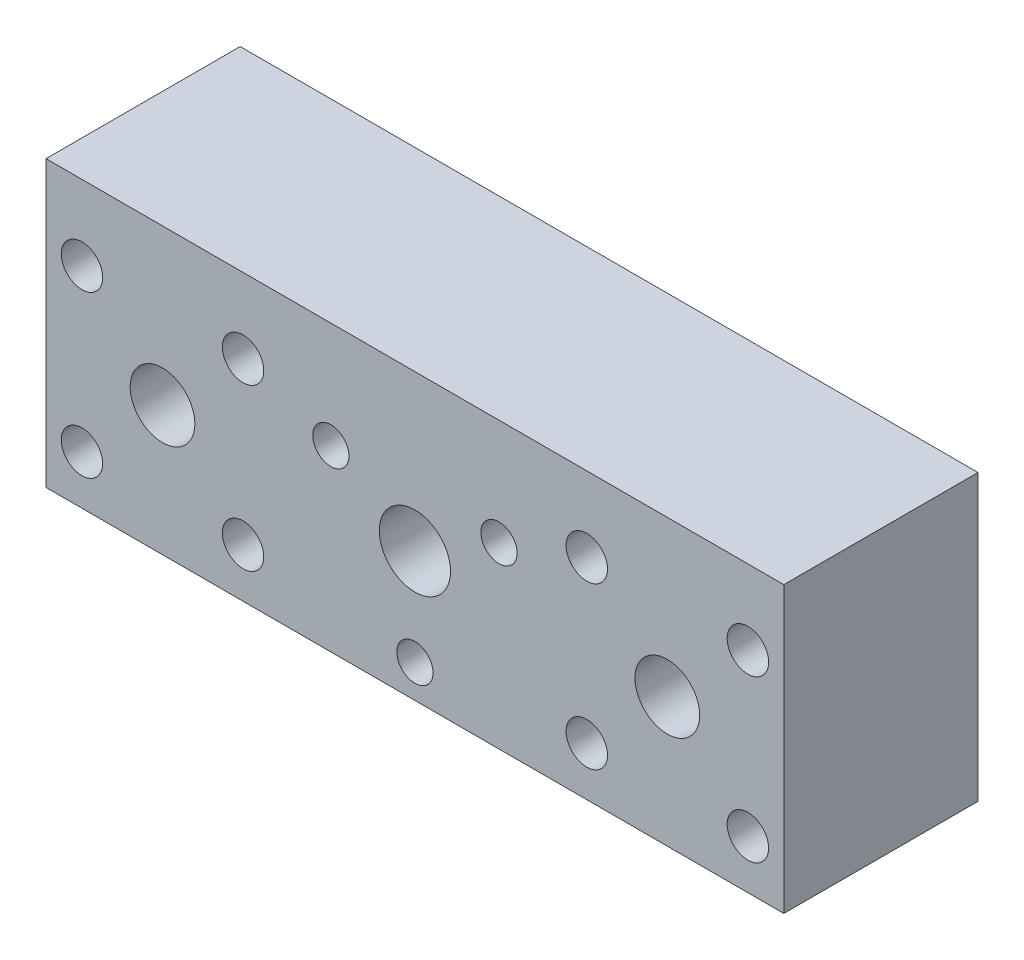
from build123d import *
from build123d.topology import SkipClean

# Parameters (mm, degrees)
SKETCH1_W           = 72.39
SKETCH1_H           = 22.86
BOSS_EXTRUDE1_DEPTH = 6.35
SKETCH1_3_R         = 3.4925
SKETCH1_3_R_2       = 3.175
CUT_EXTRUDE3_DEPTH  = 12.7
SKETCH2_R           = 2.032
CUT_EXTRUDE4_DEPTH  = 39.484352989
SKETCH3_R           = 1.778
CUT_EXTRUDE5_DEPTH  = 39.484352989
SKETCH4_W           = 72.39
SKETCH4_H           = 6.35
BOSS_EXTRUDE2_DEPTH = 1.27
SKETCH5_W           = 72.39
SKETCH5_H           = 6.35
BOSS_EXTRUDE3_DEPTH = 3.81
BOSS_EXTRUDE4_START = 12.7
SKETCH7_W           = 72.39
SKETCH7_H           = 27.94
SKETCH7_R           = 3.175
SKETCH7_R_2         = 3.4925
BOSS_EXTRUDE4_DEPTH = 12.7


with BuildPart() as part:
    # Sketch1 → Boss-Extrude1 (new body)
    with BuildSketch(Plane.XY):
        Rectangle(SKETCH1_W, SKETCH1_H)
    extrude(amount=BOSS_EXTRUDE1_DEPTH)

    # Sketch1<3> → Cut-Extrude3 (cut)
    with BuildSketch(Plane.XY):
        Circle(SKETCH1_3_R)
        with Locations((-24.765, 0)):
            Circle(SKETCH1_3_R_2)
        with Locations((24.765, 0)):
            Circle(SKETCH1_3_R_2)
    extrude(amount=CUT_EXTRUDE3_DEPTH, mode=Mode.SUBTRACT)

    # Sketch2 → Cut-Extrude4 (cut, through all)
    with BuildSketch(Plane.XY.offset(6.35)):
        with Locations((32.667625387, -7.902625387)):
            Circle(SKETCH2_R)
        with Locations((32.667625387, 7.902625387)):
            Circle(SKETCH2_R)
        with Locations((16.862374613, 7.902625387)):
            Circle(SKETCH2_R)
        with Locations((16.862374613, -7.902625387)):
            Circle(SKETCH2_R)
        with Locations((-16.862374613, 7.902625387)):
            Circle(SKETCH2_R)
        with Locations((-32.667625387, 7.902625387)):
            Circle(SKETCH2_R)
        with Locations((-16.862374613, -7.902625387)):
            Circle(SKETCH2_R)
        with Locations((-32.667625387, -7.902625387)):
            Circle(SKETCH2_R)
    extrude(amount=-CUT_EXTRUDE4_DEPTH, mode=Mode.SUBTRACT)

    # Sketch3 → Cut-Extrude5 (cut, through all)
    with BuildSketch(Plane.XY.offset(6.35)):
        with Locations((8.24865, 4.826)):
            Circle(SKETCH3_R)
        with Locations((-8.24865, 4.826)):
            Circle(SKETCH3_R)
        with Locations((0, -9.461080894)):
            Circle(SKETCH3_R)
    extrude(amount=-CUT_EXTRUDE5_DEPTH, mode=Mode.SUBTRACT)

    # Sketch4 → Boss-Extrude2 (add)
    with BuildSketch(Plane.XZ.offset(11.43)):
        with Locations((0, 3.175)):
            Rectangle(SKETCH4_W, SKETCH4_H)
    extrude(amount=BOSS_EXTRUDE2_DEPTH)

    # Sketch5 → Boss-Extrude3 (add)
    with BuildSketch(Plane(origin=(0, 11.43, 0), x_dir=(1, 0, 0), z_dir=(0, 1, 0))):
        with Locations((0, -3.175)):
            Rectangle(SKETCH5_W, SKETCH5_H)
    extrude(amount=BOSS_EXTRUDE3_DEPTH)

    # Sketch7 → Boss-Extrude4 (add)
    with SkipClean():  # the faces are left unmerged after this step: merging them gives an invalid solid
        with BuildSketch(Plane(origin=(0, 0, 0), x_dir=(-1, 0, 0), z_dir=(0, 0, -1)).offset(BOSS_EXTRUDE4_START)):
            with Locations((0, 1.27)):
                Rectangle(SKETCH7_W, SKETCH7_H)
            with Locations((-24.765, 0)):
                Circle(SKETCH7_R, mode=Mode.SUBTRACT)
            Circle(SKETCH7_R_2, mode=Mode.SUBTRACT)
            with Locations((24.765, 0)):
                Circle(SKETCH7_R, mode=Mode.SUBTRACT)
        extrude(amount=-BOSS_EXTRUDE4_DEPTH)


solid = part.part
